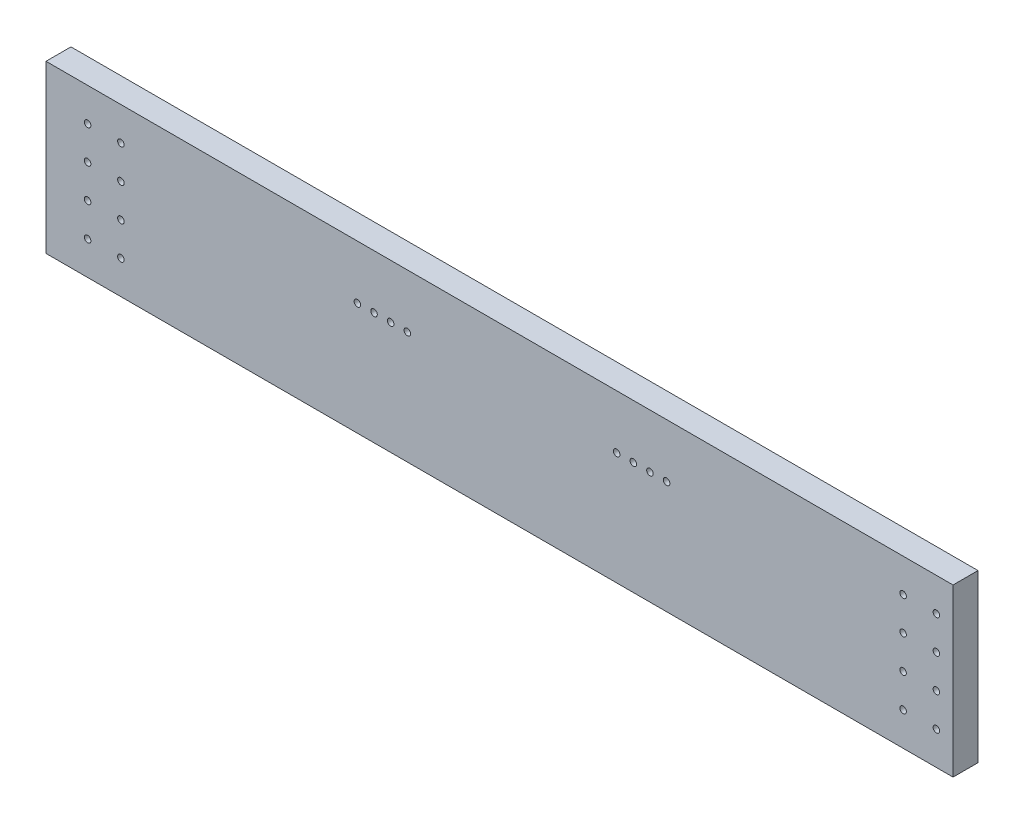
from build123d import *

# Parameters (mm, degrees)
SKETCH1_W               = 692.15
SKETCH1_H               = 19.05
BOSS_EXTRUDE1_DEPTH     = 63.5
SKETCH2_R               = 2.4892
CUT_EXTRUDE1_DEPTH      = 671.037845946
LPATTERN1_COUNT         = 4
LPATTERN1_PITCH         = 25.4
SKETCH3_R               = 2.4892
CUT_EXTRUDE2_DEPTH      = 671.037845946
MIRROR1_COPY_1_SKETCH_R = 2.4892
MIRROR1_COPY_1_DEPTH    = 671.037845946
MIRROR1_COPY_2_SKETCH_R = 2.4892
MIRROR1_COPY_2_DEPTH    = 671.037845946
MIRROR1_COPY_3_SKETCH_R = 2.4892
MIRROR1_COPY_3_DEPTH    = 671.037845946


with BuildPart() as part:
    # Sketch1 → Boss-Extrude1 (new, symmetric)
    with BuildSketch(Plane(origin=(0, 0, 0), x_dir=(1, 0, 0), z_dir=(0, 1, 0))):
        with Locations((320.675, -15.875)):
            Rectangle(SKETCH1_W, SKETCH1_H)
    extrude(amount=BOSS_EXTRUDE1_DEPTH, both=True)

    # Sketch2 → Cut-Extrude1 (cut, through all)
    with BuildSketch(Plane.XY.offset(25.4)):
        with Locations((6.35, -38.1)):
            Circle(SKETCH2_R)
        with Locations((31.75, -38.1)):
            Circle(SKETCH2_R)
    cut_extrude1 = extrude(amount=-CUT_EXTRUDE1_DEPTH, mode=Mode.SUBTRACT)

    # LPattern1: Cut-Extrude1 ×4
    with Locations(*[(0, i * LPATTERN1_PITCH, 0) for i in range(1, LPATTERN1_COUNT)]):
        add(cut_extrude1, mode=Mode.SUBTRACT)

    # Sketch3 → Cut-Extrude2 (cut, through all)
    with BuildSketch(Plane.XY.offset(25.4)):
        with Locations((212.217, 22.479)):
            Circle(SKETCH3_R)
        with Locations((224.917, 22.479)):
            Circle(SKETCH3_R)
        with Locations((237.617, 22.479)):
            Circle(SKETCH3_R)
        with Locations((250.317, 22.479)):
            Circle(SKETCH3_R)
    cut_extrude2 = extrude(amount=-CUT_EXTRUDE2_DEPTH, mode=Mode.SUBTRACT)

    # Mirror1: Cut-Extrude1, Cut-Extrude2 across plane
    add(cut_extrude1.mirror(Plane(origin=(330.2, 0, 0), x_dir=(0, 0, 1), z_dir=(1, 0, 0))), mode=Mode.SUBTRACT)
    add(cut_extrude2.mirror(Plane(origin=(330.2, 0, 0), x_dir=(0, 0, 1), z_dir=(1, 0, 0))), mode=Mode.SUBTRACT)

    # Mirror1 copy 1 sketch → Mirror1 copy 1 (cut, through all)
    with BuildSketch(Plane(origin=(660.4, 25.4, 25.4), x_dir=(-1, 0, 0), z_dir=(0, 0, 1))):
        with Locations((6.35, 38.1)):
            Circle(MIRROR1_COPY_1_SKETCH_R)
        with Locations((31.75, 38.1)):
            Circle(MIRROR1_COPY_1_SKETCH_R)
    extrude(amount=-MIRROR1_COPY_1_DEPTH, mode=Mode.SUBTRACT)

    # Mirror1 copy 2 sketch → Mirror1 copy 2 (cut, through all)
    with BuildSketch(Plane(origin=(660.4, 50.8, 25.4), x_dir=(-1, 0, 0), z_dir=(0, 0, 1))):
        with Locations((6.35, 38.1)):
            Circle(MIRROR1_COPY_2_SKETCH_R)
        with Locations((31.75, 38.1)):
            Circle(MIRROR1_COPY_2_SKETCH_R)
    extrude(amount=-MIRROR1_COPY_2_DEPTH, mode=Mode.SUBTRACT)

    # Mirror1 copy 3 sketch → Mirror1 copy 3 (cut, through all)
    with BuildSketch(Plane(origin=(660.4, 76.2, 25.4), x_dir=(-1, 0, 0), z_dir=(0, 0, 1))):
        with Locations((6.35, 38.1)):
            Circle(MIRROR1_COPY_3_SKETCH_R)
        with Locations((31.75, 38.1)):
            Circle(MIRROR1_COPY_3_SKETCH_R)
    extrude(amount=-MIRROR1_COPY_3_DEPTH, mode=Mode.SUBTRACT)


solid = part.part
